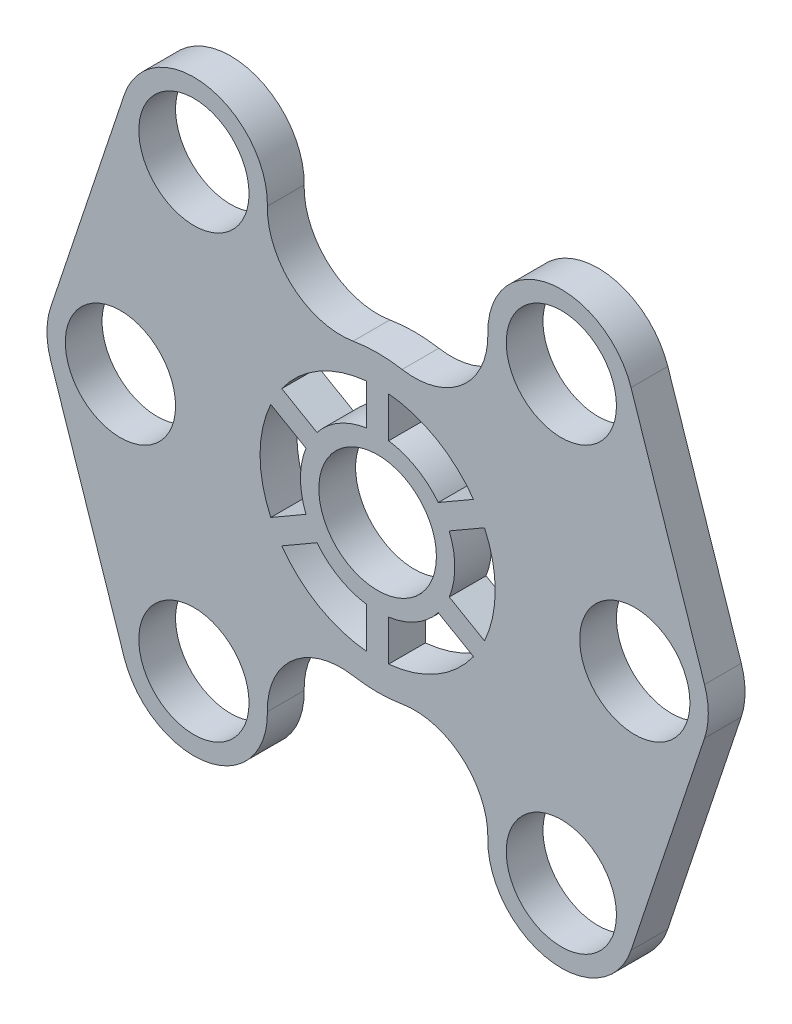
from build123d import *

# Parameters (mm, degrees)
SKETCH1_R           = 15
SKETCH1_R_2         = 16
BOSS_EXTRUDE1_DEPTH = 10


with BuildPart() as part:
    # Sketch1 → Boss-Extrude1 (new body)
    with BuildSketch(Plane.XY):
        with BuildLine():
            Line((88.973665961, 6.32455532), (68.973665961, 66.32455532))
            ThreePointArc((68.973665961, 66.32455532), (46.589060398, 79.706990918), (30.004417802, 59.579651831))
            ThreePointArc((30.004417802, 59.579651831), (23.077468599, 44.01959324), (6.67255707, 39.439535775))
            ThreePointArc((6.67255707, 39.439535775), (0, 40), (-6.67255707, 39.439535775))
            ThreePointArc((-6.67255707, 39.439535775), (-23.077468599, 44.01959324), (-30.004417802, 59.579651831))
            ThreePointArc((-30.004417802, 59.579651831), (-46.589060398, 79.706990918), (-68.973665961, 66.32455532))
            Line((-68.973665961, 66.32455532), (-88.973665961, 6.32455532))
            ThreePointArc((-88.973665961, 6.32455532), (-90, 0), (-88.973665961, -6.32455532))
            Line((-88.973665961, -6.32455532), (-68.973665961, -66.32455532))
            ThreePointArc((-68.973665961, -66.32455532), (-46.589060398, -79.706990918), (-30.004417802, -59.579651831))
            ThreePointArc((-30.004417802, -59.579651831), (-23.077468599, -44.01959324), (-6.67255707, -39.439535775))
            ThreePointArc((-6.67255707, -39.439535775), (0, -40), (6.67255707, -39.439535775))
            ThreePointArc((6.67255707, -39.439535775), (23.077468599, -44.01959324), (30.004417802, -59.579651831))
            ThreePointArc((30.004417802, -59.579651831), (46.589060398, -79.706990918), (68.973665961, -66.32455532))
            Line((68.973665961, -66.32455532), (88.973665961, -6.32455532))
            ThreePointArc((88.973665961, -6.32455532), (90, 0), (88.973665961, 6.32455532))
        make_face()
        with Locations((-50, -60)):
            Circle(SKETCH1_R, mode=Mode.SUBTRACT)
        with BuildLine():
            ThreePointArc((-16.5, -12.990381057), (-10.5, -18.186533479), (-3, -20.784609691))
            Line((-3, -20.784609691), (-3, -31.859064644))
            ThreePointArc((-3, -31.859064644), (-16, -27.712812921), (-26.090759323, -18.527608533))
            Line((-26.090759323, -18.527608533), (-16.5, -12.990381057))
        make_face(mode=Mode.SUBTRACT)
        with Locations((50, -60)):
            Circle(SKETCH1_R, mode=Mode.SUBTRACT)
        with BuildLine():
            Line((3, -31.859064644), (3, -20.784609691))
            ThreePointArc((3, -20.784609691), (10.5, -18.186533479), (16.5, -12.990381057))
            Line((16.5, -12.990381057), (26.090759323, -18.527608533))
            ThreePointArc((26.090759323, -18.527608533), (16, -27.712812921), (3, -31.859064644))
        make_face(mode=Mode.SUBTRACT)
        with BuildLine():
            ThreePointArc((-19.5, 7.794228634), (-21, 0), (-19.5, -7.794228634))
            Line((-19.5, -7.794228634), (-29.090759323, -13.331456111))
            ThreePointArc((-29.090759323, -13.331456111), (-32, 0), (-29.090759323, 13.331456111))
            Line((-29.090759323, 13.331456111), (-19.5, 7.794228634))
        make_face(mode=Mode.SUBTRACT)
        Circle(SKETCH1_R_2, mode=Mode.SUBTRACT)
        with BuildLine():
            ThreePointArc((-3, 20.784609691), (-10.5, 18.186533479), (-16.5, 12.990381057))
            Line((-16.5, 12.990381057), (-26.090759323, 18.527608533))
            ThreePointArc((-26.090759323, 18.527608533), (-16, 27.712812921), (-3, 31.859064644))
            Line((-3, 31.859064644), (-3, 20.784609691))
        make_face(mode=Mode.SUBTRACT)
        with Locations((-50, 60)):
            Circle(SKETCH1_R, mode=Mode.SUBTRACT)
        with BuildLine():
            ThreePointArc((19.5, -7.794228634), (21, 0), (19.5, 7.794228634))
            Line((19.5, 7.794228634), (29.090759323, 13.331456111))
            ThreePointArc((29.090759323, 13.331456111), (32, 0), (29.090759323, -13.331456111))
            Line((29.090759323, -13.331456111), (19.5, -7.794228634))
        make_face(mode=Mode.SUBTRACT)
        with BuildLine():
            ThreePointArc((16.5, 12.990381057), (10.5, 18.186533479), (3, 20.784609691))
            Line((3, 20.784609691), (3, 31.859064644))
            ThreePointArc((3, 31.859064644), (16, 27.712812921), (26.090759323, 18.527608533))
            Line((26.090759323, 18.527608533), (16.5, 12.990381057))
        make_face(mode=Mode.SUBTRACT)
        with Locations((70, 0)):
            Circle(SKETCH1_R, mode=Mode.SUBTRACT)
        with Locations((50, 60)):
            Circle(SKETCH1_R, mode=Mode.SUBTRACT)
        with Locations((-70, 0)):
            Circle(SKETCH1_R, mode=Mode.SUBTRACT)
    extrude(amount=BOSS_EXTRUDE1_DEPTH)


solid = part.part
